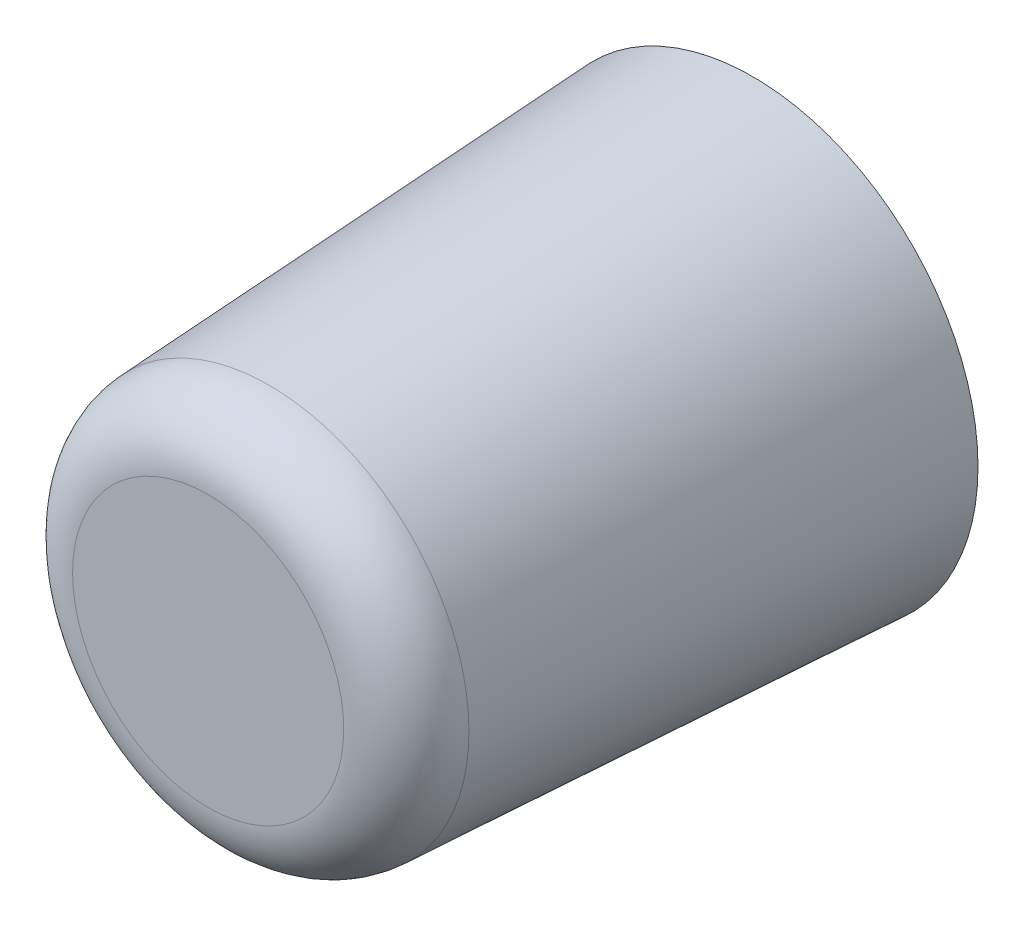
from build123d import *

# Parameters (mm, degrees)
SKETCH1_R           = 10.5
BOSS_EXTRUDE1_DEPTH = 25.4
BOSS_EXTRUDE1_TAPER = 3
FILLET1_R           = 3


with BuildPart() as part:
    # Sketch1 → Boss-Extrude1 (new body)
    with BuildSketch(Plane.XY):
        Circle(SKETCH1_R)
    extrude(amount=BOSS_EXTRUDE1_DEPTH, taper=BOSS_EXTRUDE1_TAPER)

    # Fillet1
    fillet1_edges = [part.edges().sort_by_distance(p)[0] for p in [
        (-9.168842406, 0, 25.4),
    ]]
    fillet(fillet1_edges, radius=FILLET1_R)


solid = part.part
